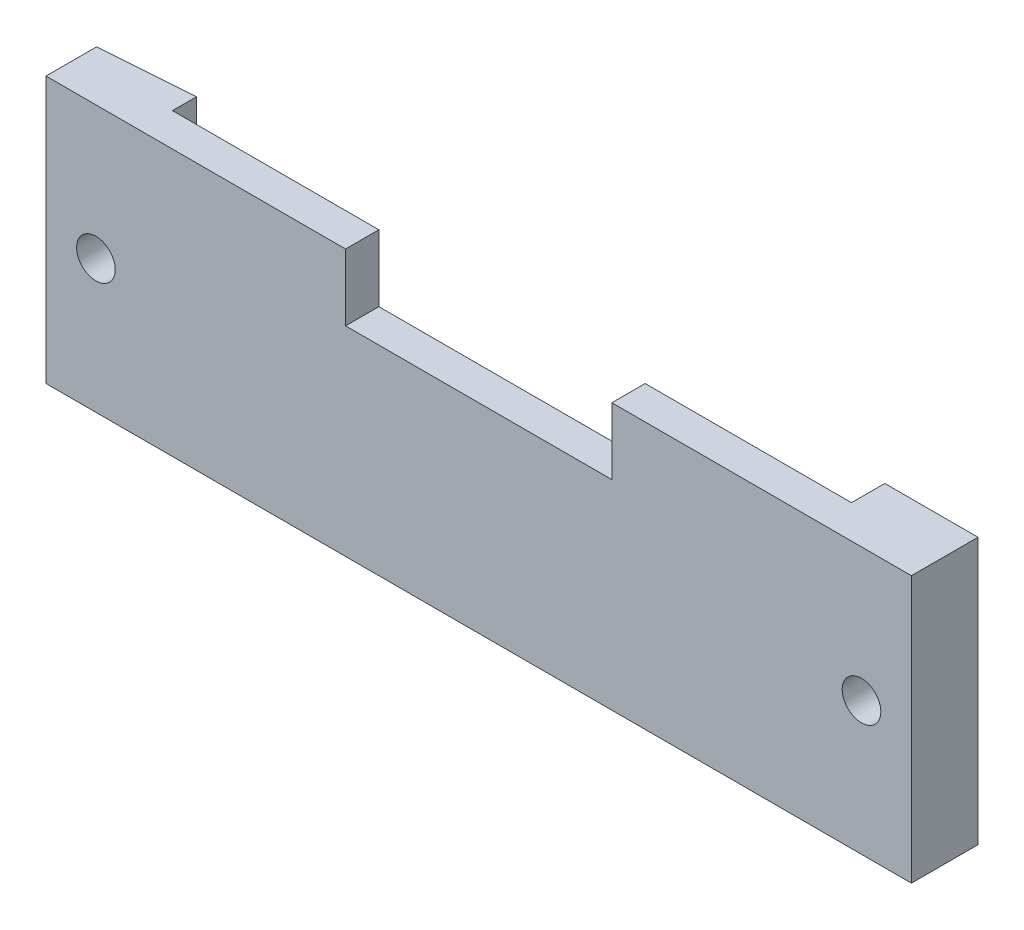
from build123d import *

# Parameters (mm, degrees)
BOSS_EXTRUDE1_DEPTH     = 5
CUT_EXTRUDE1_REACH      = 40.487
SKETCH2_W               = 51
SKETCH2_H               = 2.5
M3_5X0_6_TAPPED_HOLE4_D = 2.9
CUT_EXTRUDE2_REACH      = 40.487
CUT_EXTRUDE4_REACH      = 40.487


with BuildPart() as part:
    # Sketch1 → Boss-Extrude1 (new body)
    with BuildSketch(Plane.XY):
        Polygon((0, 0), (32.5, 0), (32.5, 20), (-32.5, 20), (-32.5, 0), align=None)
    extrude(amount=BOSS_EXTRUDE1_DEPTH)

    # Sketch2 → Cut-Extrude1 (cut, up to next)
    with BuildSketch(Plane.XZ, mode=Mode.PRIVATE) as cut_extrude1_sk1:
        with Locations((0, 1.25)):
            Rectangle(SKETCH2_W, SKETCH2_H)
    cut_extrude1_tool1 = extrude(cut_extrude1_sk1.sketch, amount=-CUT_EXTRUDE1_REACH, mode=Mode.PRIVATE) & part.part
    add(cut_extrude1_tool1.solids().sort_by_distance((0, 0, 1.25))[0], mode=Mode.SUBTRACT)

    # M3.5x0.6 Tapped Hole4 (through all)
    with Locations(Plane.XY.offset(5)):
        with Locations((-28.75, 10), (28.75, 10)):
            Hole(M3_5X0_6_TAPPED_HOLE4_D / 2)

    # Sketch12 → Cut-Extrude2 (cut, up to next)
    with BuildSketch(Plane.XY.offset(5), mode=Mode.PRIVATE) as cut_extrude2_sk1:
        Polygon((0, 20), (-10, 20), (-10, 15), (10, 15), (10, 20), align=None)
    cut_extrude2_tool1 = extrude(cut_extrude2_sk1.sketch, amount=-CUT_EXTRUDE2_REACH, mode=Mode.PRIVATE) & part.part
    add(cut_extrude2_tool1.solids().sort_by_distance((0, 17.5, 5))[0], mode=Mode.SUBTRACT)

    # Sketch14 → Cut-Extrude4 (cut, up to next)
    with BuildSketch(Plane.XZ, mode=Mode.PRIVATE) as cut_extrude4_sk1:
        Polygon((-25.5, 0), (-25.5, 0.7), (-32.5, 1.2), (-32.5, 0), align=None)
    cut_extrude4_tool1 = extrude(cut_extrude4_sk1.sketch, amount=-CUT_EXTRUDE4_REACH, mode=Mode.PRIVATE) & part.part
    add(cut_extrude4_tool1.solids().sort_by_distance((-29.307018, 0, 0.485965))[0], mode=Mode.SUBTRACT)


solid = part.part
